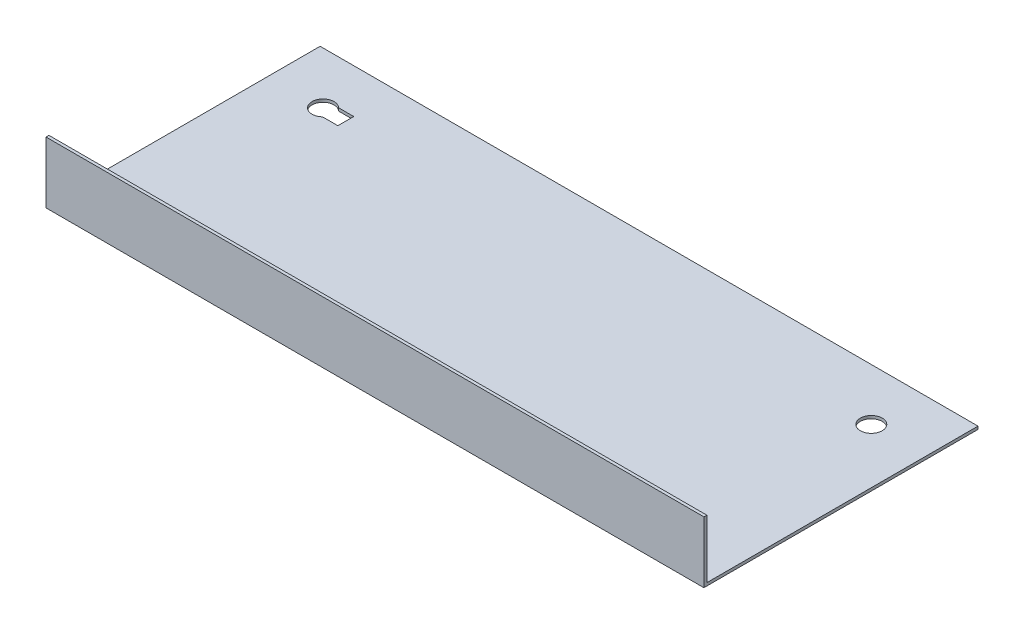
from build123d import *

# Parameters (mm, degrees)
SKETCH1_W           = 900
SKETCH1_H           = 375
BOSS_EXTRUDE1_DEPTH = 4
SKETCH2_W           = 900
SKETCH2_H           = 4
BOSS_EXTRUDE2_DEPTH = 80
SKETCH3_R           = 15
CUT_EXTRUDE1_DEPTH  = 80
CUT_EXTRUDE2_DEPTH  = 48


with BuildPart() as part:
    # Sketch1 → Boss-Extrude1 (new body)
    with BuildSketch(Plane(origin=(0, 0, 0), x_dir=(1, 0, 0), z_dir=(0, 1, 0))):
        Rectangle(SKETCH1_W, SKETCH1_H)
    extrude(amount=BOSS_EXTRUDE1_DEPTH)

    # Sketch2 → Boss-Extrude2 (add)
    with BuildSketch(Plane(origin=(0, 4, 0), x_dir=(1, 0, 0), z_dir=(0, 1, 0))):
        with Locations((0, -185.5)):
            Rectangle(SKETCH2_W, SKETCH2_H)
    extrude(amount=BOSS_EXTRUDE2_DEPTH)

    # Sketch3 → Cut-Extrude1 (cut)
    with BuildSketch(Plane(origin=(0, 4, 0), x_dir=(1, 0, 0), z_dir=(0, 1, 0))):
        with Locations(Location((375, 116.5, 0), (0, 0, 270))):
            Circle(SKETCH3_R)
        with Locations(Location((-375, 116.5, 0), (0, 0, 270))):
            Circle(SKETCH3_R)
    extrude(amount=-CUT_EXTRUDE1_DEPTH, mode=Mode.SUBTRACT)

    # Sketch6 → Cut-Extrude2 (cut)
    with BuildSketch(Plane(origin=(0, 30, 0), x_dir=(-1, 0, 0), z_dir=(0, -1, 0))):
        Polygon((375.476662109, 116.274639687), (375.476662109, 127.286348112), (343.747335513, 127.286348112), (343.747335513, 105.528943218), (375.476662109, 105.528943218), align=None)
    extrude(amount=CUT_EXTRUDE2_DEPTH, mode=Mode.SUBTRACT)


solid = part.part
